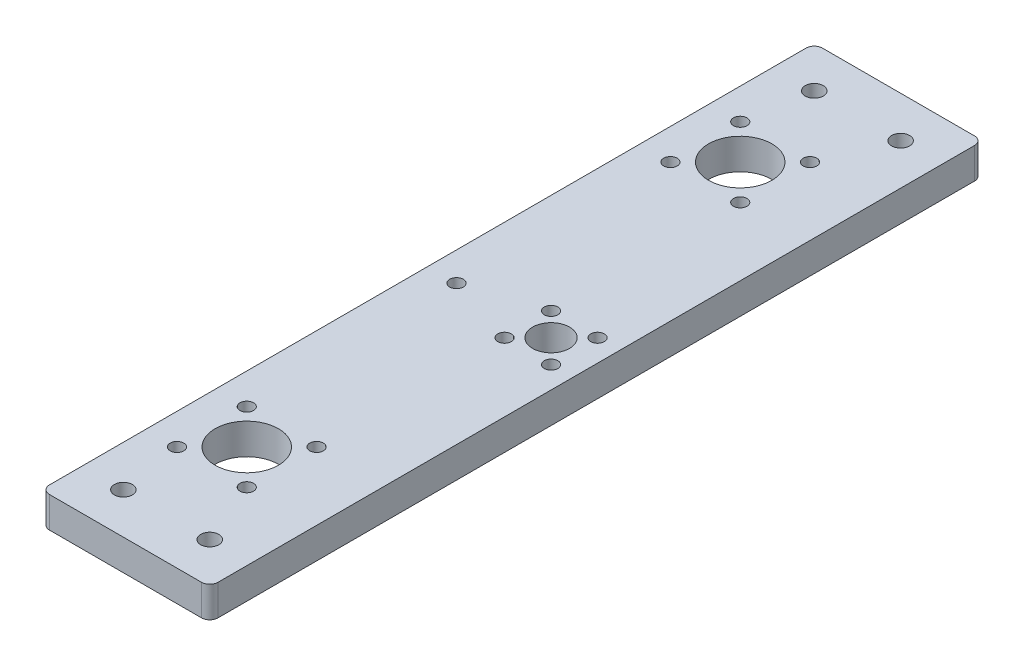
from build123d import *

# Parameters (mm, degrees)
SKETCH_1_R      = 2.2
SKETCH_1_R_2    = 1.65
SKETCH_1_R_3    = 7.7
SKETCH_1_R_4    = 4.5
EXTRUDE_1_DEPTH = 7.5


with BuildPart() as part:
    # 草图1 → 凸台-拉伸1 (new body)
    with BuildSketch(Plane(origin=(0, 7.5, 0), x_dir=(1, 0, 0), z_dir=(0, 1, 0))):
        with BuildLine():
            Line((18.5, 94), (-18.5, 94))
            ThreePointArc((-18.5, 94), (-19.914213562, 93.414213562), (-20.5, 92))
            Line((-20.5, 92), (-20.5, -92))
            ThreePointArc((-20.5, -92), (-19.914213562, -93.414213562), (-18.5, -94))
            Line((-18.5, -94), (18.5, -94))
            ThreePointArc((18.5, -94), (19.914213562, -93.414213562), (20.5, -92))
            Line((20.5, -92), (20.5, 92))
            ThreePointArc((20.5, 92), (19.914213562, 93.414213562), (18.5, 94))
        make_face()
        with Locations(Location((10.5, 84, 0), (0, 0, 90))):
            Circle(SKETCH_1_R, mode=Mode.SUBTRACT)
        with Locations(Location((-10.5, 84, 0), (0, 0, 90))):
            Circle(SKETCH_1_R, mode=Mode.SUBTRACT)
        with Locations(Location((10.5, -84, 0), (0, 0, 90))):
            Circle(SKETCH_1_R, mode=Mode.SUBTRACT)
        with Locations(Location((-10.5, -84, 0), (0, 0, 90))):
            Circle(SKETCH_1_R, mode=Mode.SUBTRACT)
        with Locations(Location((3.985281374, 51.514718626, 0), (0, 0, 90))):
            Circle(SKETCH_1_R_2, mode=Mode.SUBTRACT)
        with Locations(Location((15.156854249, 5.656854249, 0), (0, 0, 90))):
            Circle(SKETCH_1_R_2, mode=Mode.SUBTRACT)
        with Locations(Location((-12.985281374, -68.485281374, 0), (0, 0, 90))):
            Circle(SKETCH_1_R_2, mode=Mode.SUBTRACT)
        with Locations(Location((3.985281374, -68.485281374, 0), (0, 0, 90))):
            Circle(SKETCH_1_R_2, mode=Mode.SUBTRACT)
        with Locations(Location((-4.5, -60, 0), (0, 0, 90))):
            Circle(SKETCH_1_R_3, mode=Mode.SUBTRACT)
        with Locations(Location((9.5, 0, 0), (0, 0, 90))):
            Circle(SKETCH_1_R_4, mode=Mode.SUBTRACT)
        with Locations(Location((-12.985281374, -51.514718626, 0), (0, 0, 90))):
            Circle(SKETCH_1_R_2, mode=Mode.SUBTRACT)
        with Locations(Location((3.985281374, -51.514718626, 0), (0, 0, 90))):
            Circle(SKETCH_1_R_2, mode=Mode.SUBTRACT)
        with Locations(Location((3.985281374, 68.485281374, 0), (0, 0, 90))):
            Circle(SKETCH_1_R_2, mode=Mode.SUBTRACT)
        with Locations(Location((-12.985281374, 68.485281374, 0), (0, 0, 90))):
            Circle(SKETCH_1_R_2, mode=Mode.SUBTRACT)
        with Locations(Location((-12.985281374, 51.514718626, 0), (0, 0, 90))):
            Circle(SKETCH_1_R_2, mode=Mode.SUBTRACT)
        with Locations(Location((3.843145751, 5.656854249, 0), (0, 0, 90))):
            Circle(SKETCH_1_R_2, mode=Mode.SUBTRACT)
        with Locations(Location((3.843145751, -5.656854249, 0), (0, 0, 90))):
            Circle(SKETCH_1_R_2, mode=Mode.SUBTRACT)
        with Locations(Location((15.156854249, -5.656854249, 0), (0, 0, 90))):
            Circle(SKETCH_1_R_2, mode=Mode.SUBTRACT)
        with Locations(Location((-13.5, 0, 0), (0, 0, 90))):
            Circle(SKETCH_1_R_2, mode=Mode.SUBTRACT)
        with Locations(Location((-4.5, 60, 0), (0, 0, 90))):
            Circle(SKETCH_1_R_3, mode=Mode.SUBTRACT)
    extrude(amount=-EXTRUDE_1_DEPTH)


solid = part.part
